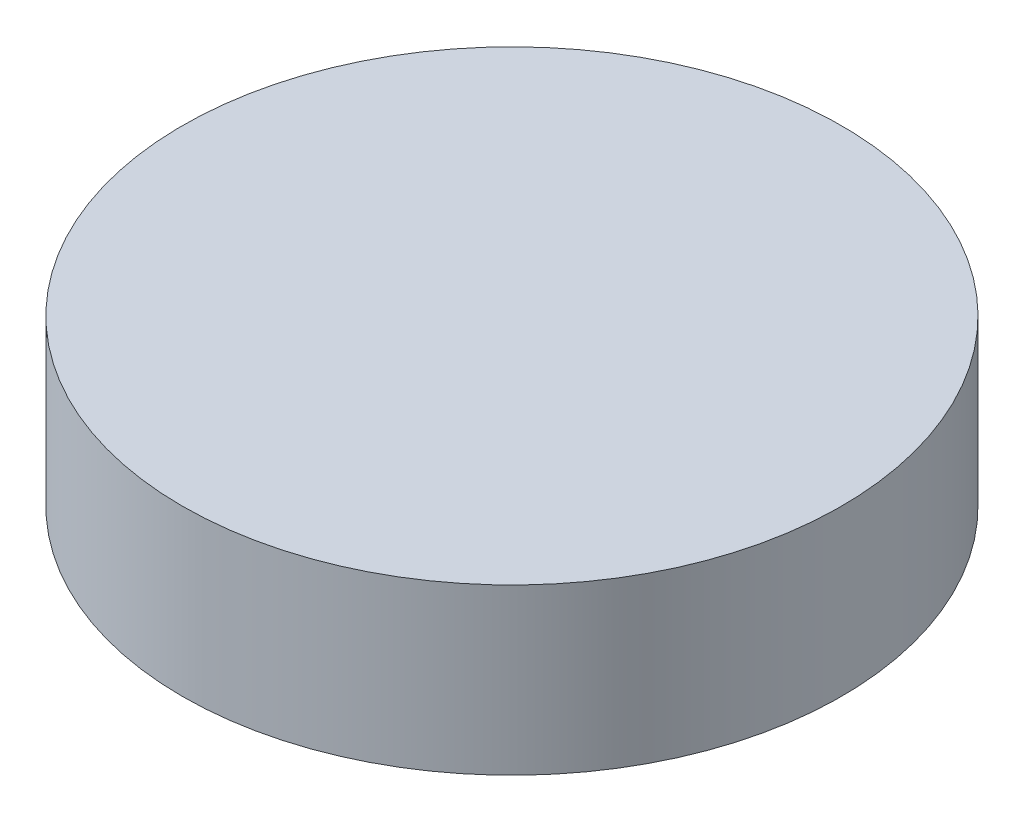
from build123d import *

# Parameters (mm, degrees)
SKETCH1_R           = 127
BOSS_EXTRUDE1_DEPTH = 63.5


with BuildPart() as part:
    # Sketch1 → Boss-Extrude1 (new body)
    with BuildSketch(Plane(origin=(0, 0, 0), x_dir=(1, 0, 0), z_dir=(0, 1, 0))):
        with Locations(Location((0, 0, 0), (0, 0, 270))):
            Circle(SKETCH1_R)
    extrude(amount=BOSS_EXTRUDE1_DEPTH)


solid = part.part
